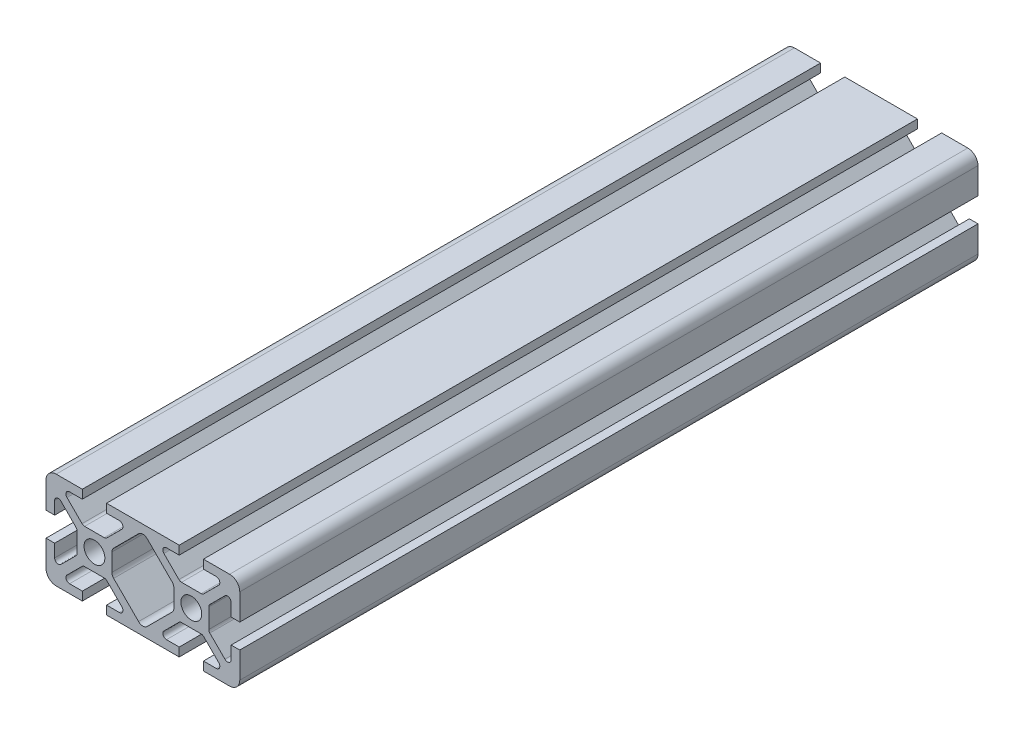
from build123d import *

# Parameters (mm, degrees)
BOSS_EXTRUDE1_DEPTH = 76.2
BOSS_EXTRUDE2_DEPTH = 76.2
FILLET1_R           = 0.75
FILLET2_R           = 1.25


with BuildPart() as part:
    # Sketch3 → Boss-Extrude1 (new, symmetric)
    with BuildSketch(Plane.XY):
        with BuildLine():
            Line((12.5, -10), (17.9, -10))
            ThreePointArc((17.9, -10), (19.38492424, -9.38492424), (20, -7.9))
            Line((20, -7.9), (20, -2.5))
            Line((20, -2.5), (18.213351365, -2.5))
            Line((18.213351365, -2.5), (18.213351365, -6.95))
            Line((18.213351365, -6.95), (13.6, -2.336648635))
            Line((13.6, -2.336648635), (13.6, 0))
            Line((13.6, 0), (12.15, 0))
            ThreePointArc((12.15, 0), (11.52027958, -1.52027958), (10, -2.15))
            Line((10, -2.15), (10, -3.6))
            Line((10, -3.6), (12.336648635, -3.6))
            Line((12.336648635, -3.6), (16.95, -8.213351365))
            Line((16.95, -8.213351365), (12.5, -8.213351365))
            Line((12.5, -8.213351365), (12.5, -10))
        make_face()
    extrude(amount=BOSS_EXTRUDE1_DEPTH, both=True)

    # Sketch4 → Boss-Extrude2 (add, symmetric)
    with BuildSketch(Plane.XY):
        with BuildLine():
            Line((10, -3.6), (7.663351365, -3.6))
            Line((7.663351365, -3.6), (3.05, -8.213351365))
            Line((3.05, -8.213351365), (7.5, -8.213351365))
            Line((7.5, -8.213351365), (7.5, -10))
            Line((7.5, -10), (0, -10))
            Line((0, -10), (0, -8.736648635))
            Line((0, -8.736648635), (6.4, -2.336648635))
            Line((6.4, -2.336648635), (6.4, 0))
            Line((6.4, 0), (7.85, 0))
            ThreePointArc((7.85, 0), (8.47972042, -1.52027958), (10, -2.15))
            Line((10, -2.15), (10, -3.6))
        make_face()
    extrude(amount=BOSS_EXTRUDE2_DEPTH, both=True)

    # Mirror1: part across plane


with BuildPart() as part_1:
    add(part.part)
    add(part.part.mirror(Plane(origin=(0, 0, 0), x_dir=(0, 0, 1), z_dir=(1, 0, 0))))

    # Mirror2: part across plane


with BuildPart() as part_2:
    add(part_1.part)
    add(part_1.part.mirror(Plane.ZX))

    # Fillet1
    fillet1_edges = [part_2.edges().sort_by_distance(p)[0] for p in [
        (18.213351365, 6.95, 0),
        (13.6, 2.336648635, 0),
        (12.336648635, 3.6, 0),
        (16.95, 8.213351365, 0),
        (3.05, 8.213351365, 0),
        (7.663351365, 3.6, 0),
        (-18.213351365, 6.95, 0),
        (-13.6, 2.336648635, 0),
        (-7.663351365, 3.6, 0),
        (-12.336648635, 3.6, 0),
        (-16.95, 8.213351365, 0),
        (-3.05, 8.213351365, 0),
        (16.95, -8.213351365, 0),
        (12.336648635, -3.6, 0),
        (13.6, -2.336648635, 0),
        (18.213351365, -6.95, 0),
        (3.05, -8.213351365, 0),
        (7.663351365, -3.6, 0),
        (-18.213351365, -6.95, 0),
        (-13.6, -2.336648635, 0),
        (-12.336648635, -3.6, 0),
        (-16.95, -8.213351365, 0),
        (-3.05, -8.213351365, 0),
        (-7.663351365, -3.6, 0),
    ]]
    fillet(fillet1_edges, radius=FILLET1_R)

    # Fillet2
    fillet2_edges = [part_2.edges().sort_by_distance(p)[0] for p in [
        (6.4, 2.336648635, 0),
        (0, 8.736648635, 0),
        (-6.4, 2.336648635, 0),
        (6.4, -2.336648635, 0),
        (-6.4, -2.336648635, 0),
        (0, -8.736648635, 0),
    ]]
    fillet(fillet2_edges, radius=FILLET2_R)


solid = part_2.part
